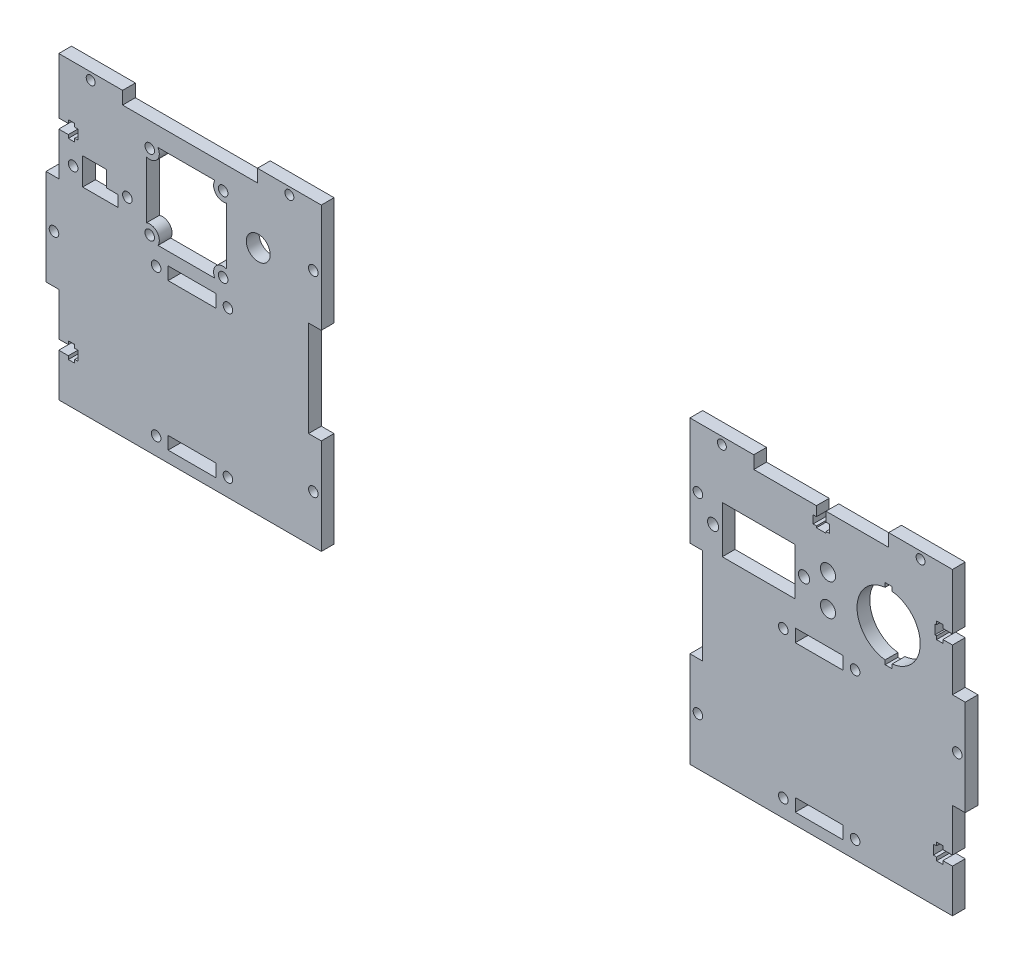
from build123d import *

# Parameters (mm, degrees)
SKETCH_1_R        = 1.5
SKETCH_1_W        = 15
SKETCH_1_H        = 4
SKETCH_1_R_2      = 3.75
SKETCH_1_R_3      = 1.4
EXTRUDE_1_DEPTH   = 4
SKETCH_1_R_4      = 1.75
SKETCH_1_R_5      = 2.375
SKETCH_1_W_2      = 22.75
SKETCH_1_H_2      = 14.75
EXTRUDE_1_2_DEPTH = 4


with BuildPart() as part:
    # Эскиз1 → Бобышка-Вытянуть1 (new body)
    with BuildSketch(Plane.XY):
        Polygon((-140, -31.5), (-140, -45), (-57.75, -45), (-57.75, -15), (-61.75, -15), (-61.75, 15), (-57.75, 15), (-57.75, 49), (-77.75, 49), (-77.75, 45), (-120, 45), (-120, 49), (-140, 49), (-140, 31.5), (-137, 31.5), (-137, 32.55), (-135, 32.55), (-135, 31.5), (-134, 31.5), (-134, 28.5), (-135, 28.5), (-135, 27.45), (-137, 27.45), (-137, 28.5), (-140, 28.5), (-140, 15), (-144, 15), (-144, -15), (-140, -15), (-140, -28.5), (-137, -28.5), (-137, -27.45), (-135, -27.45), (-135, -28.5), (-134, -28.5), (-134, -31.5), (-135, -31.5), (-135, -32.55), (-137, -32.55), (-137, -31.5), align=None)
        with Locations((-109.5, -39.5)):
            Circle(SKETCH_1_R, mode=Mode.SUBTRACT)
        with Locations((-98.25, -39.5)):
            Rectangle(SKETCH_1_W, SKETCH_1_H, mode=Mode.SUBTRACT)
        with Locations((-87, -39.5)):
            Circle(SKETCH_1_R, mode=Mode.SUBTRACT)
        with Locations((-60.25, -30)):
            Circle(SKETCH_1_R, mode=Mode.SUBTRACT)
        with Locations((-109.5, 6.5)):
            Circle(SKETCH_1_R, mode=Mode.SUBTRACT)
        with Locations((-98.25, 6.5)):
            Rectangle(SKETCH_1_W, SKETCH_1_H, mode=Mode.SUBTRACT)
        with Locations((-87, 6.5)):
            Circle(SKETCH_1_R, mode=Mode.SUBTRACT)
        with Locations((-135.5, 20.75)):
            Circle(SKETCH_1_R, mode=Mode.SUBTRACT)
        Polygon((-121.5, 16.5), (-132.5, 16.5), (-132.5, 25), (-125, 25), (-125, 20), (-121.5, 20), align=None, mode=Mode.SUBTRACT)
        with Locations((-118.5, 20.75)):
            Circle(SKETCH_1_R, mode=Mode.SUBTRACT)
        with BuildLine():
            Line((-87.5, 34.671572875), (-87.5, 16.828427125))
            ThreePointArc((-87.5, 16.828427125), (-90.819380314, 15.902754572), (-91.078427125, 12.466470228))
            Line((-91.078427125, 12.466470228), (-108.921572875, 12.466470228))
            ThreePointArc((-108.921572875, 12.466470228), (-109.180619686, 15.902754572), (-112.5, 16.828427125))
            Line((-112.5, 16.828427125), (-112.5, 34.671572875))
            ThreePointArc((-112.5, 34.671572875), (-109.180619686, 35.597245428), (-108.921572875, 39.033529772))
            Line((-108.921572875, 39.033529772), (-91.078427125, 39.033529772))
            ThreePointArc((-91.078427125, 39.033529772), (-90.819380314, 35.597245428), (-87.5, 34.671572875))
        make_face(mode=Mode.SUBTRACT)
        with Locations((-77.5, 27.5)):
            Circle(SKETCH_1_R_2, mode=Mode.SUBTRACT)
        with Locations((-60.25, 30)):
            Circle(SKETCH_1_R, mode=Mode.SUBTRACT)
        with Locations((-141.5, 0)):
            Circle(SKETCH_1_R, mode=Mode.SUBTRACT)
        with Locations((-67.75, 46.75)):
            Circle(SKETCH_1_R_3, mode=Mode.SUBTRACT)
        with Locations((-130, 46.75)):
            Circle(SKETCH_1_R_3, mode=Mode.SUBTRACT)
        with Locations((-111.5, 37.5)):
            Circle(SKETCH_1_R, mode=Mode.SUBTRACT)
        with Locations((-88.5, 37.5)):
            Circle(SKETCH_1_R, mode=Mode.SUBTRACT)
        with Locations((-111.5, 14)):
            Circle(SKETCH_1_R, mode=Mode.SUBTRACT)
        with Locations((-88.5, 14)):
            Circle(SKETCH_1_R, mode=Mode.SUBTRACT)
    extrude(amount=EXTRUDE_1_DEPTH)


with BuildPart() as body_2:
    # Эскиз1 → Extrude 1 2 (new body)
    with BuildSketch(Plane.XY):
        Polygon((57.75, -15), (57.75, -45), (140, -45), (140, -31.5), (137, -31.5), (137, -32.55), (135, -32.55), (135, -31.5), (134, -31.5), (134, -28.5), (135, -28.5), (135, -27.45), (137, -27.45), (137, -28.5), (140, -28.5), (140, -15), (144, -15), (144, 15), (140, 15), (140, 28.5), (137, 28.5), (137, 27.45), (135, 27.45), (135, 28.5), (134.5, 28.5), (134.5, 31.5), (135, 31.5), (135, 32.55), (137, 32.55), (137, 31.5), (140, 31.5), (140, 49), (120, 49), (120, 45), (100.375, 45), (100.375, 42), (101.425, 42), (101.425, 39.5), (100.375, 39.5), (100.375, 39), (97.375, 39), (97.375, 39.5), (96.325, 39.5), (96.325, 42), (97.375, 42), (97.375, 45), (77.75, 45), (77.75, 49), (57.75, 49), (57.75, 15), (61.75, 15), (61.75, -15), align=None)
        with Locations((60.25, -30)):
            Circle(SKETCH_1_R, mode=Mode.SUBTRACT)
        with Locations((87, -39.5)):
            Circle(SKETCH_1_R, mode=Mode.SUBTRACT)
        with Locations((98.25, -39.5)):
            Rectangle(SKETCH_1_W, SKETCH_1_H, mode=Mode.SUBTRACT)
        with Locations((109.5, -39.5)):
            Circle(SKETCH_1_R, mode=Mode.SUBTRACT)
        with Locations((65, 23.75)):
            Circle(SKETCH_1_R_4, mode=Mode.SUBTRACT)
        with Locations((87, 6.5)):
            Circle(SKETCH_1_R, mode=Mode.SUBTRACT)
        with Locations((98.25, 6.5)):
            Rectangle(SKETCH_1_W, SKETCH_1_H, mode=Mode.SUBTRACT)
        with Locations((109.5, 6.5)):
            Circle(SKETCH_1_R, mode=Mode.SUBTRACT)
        with Locations((101, 18.75)):
            Circle(SKETCH_1_R_5, mode=Mode.SUBTRACT)
        with Locations((79.25, 23.75)):
            Rectangle(SKETCH_1_W_2, SKETCH_1_H_2, mode=Mode.SUBTRACT)
        with Locations((93.5, 23.75)):
            Circle(SKETCH_1_R_4, mode=Mode.SUBTRACT)
        with BuildLine():
            Line((121.1, 12.6), (118.9, 12.6))
            Line((118.9, 12.6), (118.9, 13.911300899))
            ThreePointArc((118.9, 13.911300899), (110.1, 23.75), (118.9, 33.588699101))
            Line((118.9, 33.588699101), (118.9, 34.9))
            Line((118.9, 34.9), (121.1, 34.9))
            Line((121.1, 34.9), (121.1, 33.588699101))
            ThreePointArc((121.1, 33.588699101), (129.9, 23.75), (121.1, 13.911300899))
            Line((121.1, 13.911300899), (121.1, 12.6))
        make_face(mode=Mode.SUBTRACT)
        with Locations((60.25, 30)):
            Circle(SKETCH_1_R, mode=Mode.SUBTRACT)
        with Locations((101, 28.75)):
            Circle(SKETCH_1_R_5, mode=Mode.SUBTRACT)
        with Locations((67.75, 46.75)):
            Circle(SKETCH_1_R_3, mode=Mode.SUBTRACT)
        with Locations((141.5, 0)):
            Circle(SKETCH_1_R, mode=Mode.SUBTRACT)
        with Locations((130, 46.75)):
            Circle(SKETCH_1_R_3, mode=Mode.SUBTRACT)
    extrude(amount=EXTRUDE_1_2_DEPTH)


solid = Compound([part.part, body_2.part])
